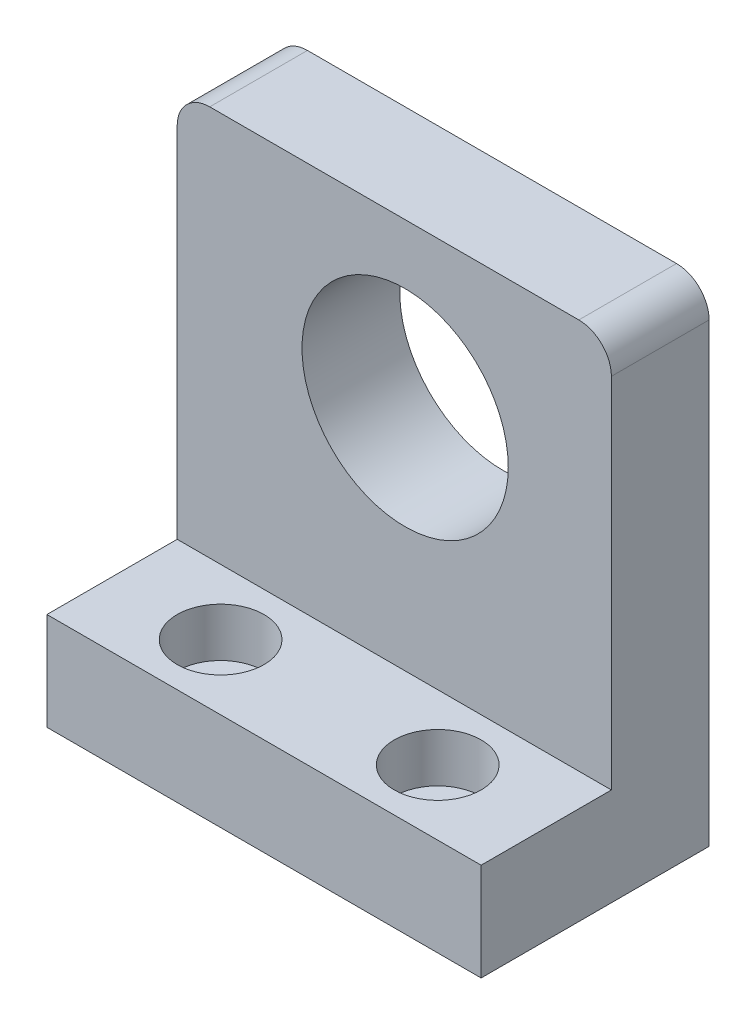
from build123d import *

# Parameters (mm, degrees)
CROQUIS1_R              = 9.5
SALIENTE_EXTRUIR1_DEPTH = 9
CROQUIS3_W              = 40
CROQUIS3_H              = 9
SALIENTE_EXTRUIR2_DEPTH = 12
CROQUIS4_R              = 2
CORTAR_EXTRUIR1_DEPTH   = 47.227697325
CROQUIS5_R              = 4
CORTAR_EXTRUIR2_DEPTH   = 4.5


with BuildPart() as part:
    # Croquis1 → Saliente-Extruir1 (new body)
    with BuildSketch(Plane.XY):
        with BuildLine():
            Line((-17, 22.5), (17, 22.5))
            ThreePointArc((17, 22.5), (19.121320344, 21.621320344), (20, 19.5))
            Line((20, 19.5), (20, -22.5))
            Line((20, -22.5), (-20, -22.5))
            Line((-20, -22.5), (-20, 19.5))
            ThreePointArc((-20, 19.5), (-19.121320344, 21.621320344), (-17, 22.5))
        make_face()
        with Locations((1, 7.5)):
            Circle(CROQUIS1_R, mode=Mode.SUBTRACT)
    extrude(amount=SALIENTE_EXTRUIR1_DEPTH)

    # Croquis3 → Saliente-Extruir2 (add)
    with BuildSketch(Plane.XY.offset(9)):
        with Locations((0, -18)):
            Rectangle(CROQUIS3_W, CROQUIS3_H)
    extrude(amount=SALIENTE_EXTRUIR2_DEPTH)

    # Croquis4 → Cortar-Extruir1 (cut, through all)
    with BuildSketch(Plane(origin=(0, -13.5, 0), x_dir=(1, 0, 0), z_dir=(0, 1, 0))):
        with Locations(Location((-10, -15, 0), (0, 0, 270))):
            Circle(CROQUIS4_R)
        with Locations(Location((10, -15, 0), (0, 0, 270))):
            Circle(CROQUIS4_R)
    extrude(amount=-CORTAR_EXTRUIR1_DEPTH, mode=Mode.SUBTRACT)

    # Croquis5 → Cortar-Extruir2 (cut)
    with BuildSketch(Plane(origin=(0, -13.5, 0), x_dir=(1, 0, 0), z_dir=(0, 1, 0))):
        with Locations(Location((-10, -15, 0), (0, 0, 270))):
            Circle(CROQUIS5_R)
        with Locations(Location((10, -15, 0), (0, 0, 270))):
            Circle(CROQUIS5_R)
    extrude(amount=-CORTAR_EXTRUIR2_DEPTH, mode=Mode.SUBTRACT)


solid = part.part
